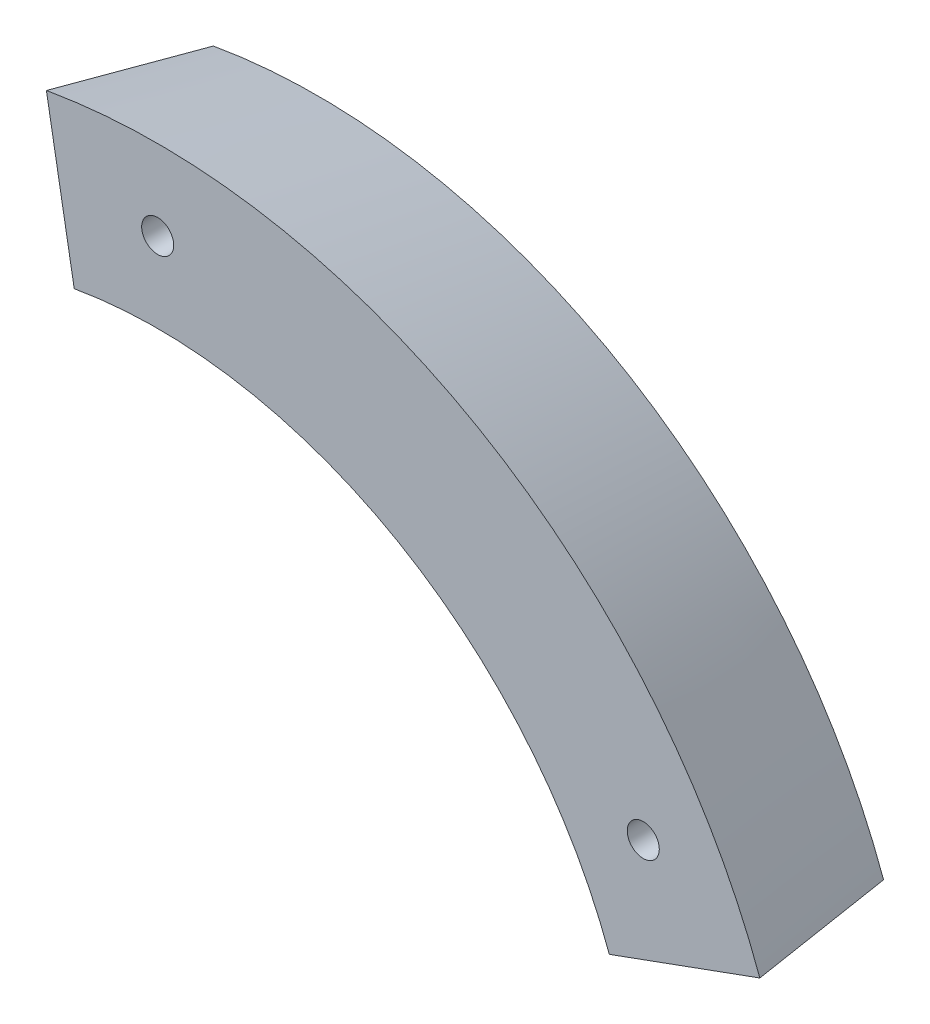
from build123d import *

# Parameters (mm, degrees)
SKETCH_1_R          = 1.5
EXTRUDE_1_DEPTH     = 15
SKETCH_2_R          = 3
CUT_EXTRUDE_1_DEPTH = 12


with BuildPart() as part:
    # 草图1 → 凸台-拉伸1 (new body)
    with BuildSketch(Plane.XY):
        with BuildLine():
            ThreePointArc((42.286167935, 15.39090645), (22.5, 38.97114317), (-7.814167995, 44.316348886))
            Line((-7.814167995, 44.316348886), (-10.41889066, 59.088465181))
            ThreePointArc((-10.41889066, 59.088465181), (30, 51.961524227), (56.381557247, 20.5212086))
            Line((56.381557247, 20.5212086), (42.286167935, 15.39090645))
        make_face()
        with Locations((45.466333699, 26.25)):
            Circle(SKETCH_1_R, mode=Mode.SUBTRACT)
        with Locations((0, 52.5)):
            Circle(SKETCH_1_R, mode=Mode.SUBTRACT)
    extrude(amount=EXTRUDE_1_DEPTH)

    # 草图2 → 切除-拉伸1 (cut)
    with BuildSketch(Plane.XY):
        with Locations((0, 52.5)):
            Circle(SKETCH_2_R)
        with Locations((45.466333699, 26.25)):
            Circle(SKETCH_2_R)
    extrude(amount=CUT_EXTRUDE_1_DEPTH, mode=Mode.SUBTRACT)

    # 草图6 → 切除-旋转1 (revolve, cut)
    with BuildSketch(Plane(origin=(0, 0, 0), x_dir=(0, 0, 1), z_dir=(-0.9848077530122092, -0.1736481776669239, 0))):
        Polygon((0, 60), (0, 56.36802701), (15, 60), align=None)
    revolve(axis=Axis((0, 0, 0), (0, 0, -1)), mode=Mode.SUBTRACT)


solid = part.part
